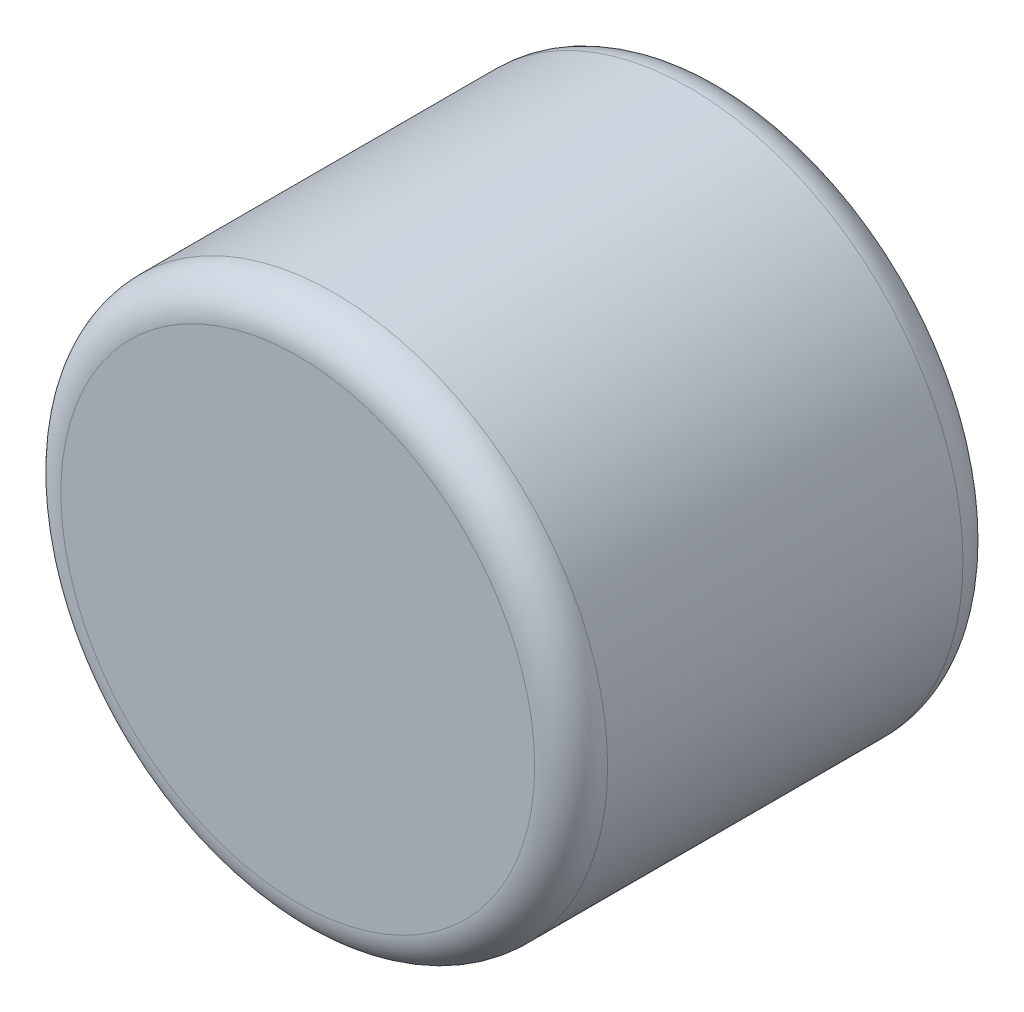
from build123d import *

# Parameters (mm, degrees)
IZIM1_R                     = 7.5
Y_KSEKLIK_EKSTR_ZYON1_DEPTH = 11.75
KES_EKSTR_ZYON1_DEPTH       = 7
RADYUS1_R                   = 1
KES_EKSTR_ZYON2_START       = -2.75
IZIM3_R                     = 3.05
KES_EKSTR_ZYON2_DEPTH       = 2.75


with BuildPart() as part:
    # Çizim1 → Yükseklik-Ekstrüzyon1 (new body)
    with BuildSketch(Plane.XY):
        Circle(IZIM1_R)
    extrude(amount=Y_KSEKLIK_EKSTR_ZYON1_DEPTH)

    # Çizim2 → Kes-Ekstrüzyon1 (cut)
    with BuildSketch(Plane.XY.offset(9.75)):
        with BuildLine():
            Line((-2.655654345, -1.5), (2.655654345, -1.5))
            ThreePointArc((2.655654345, -1.5), (0, 3.05), (-2.655654345, -1.5))
        make_face()
    extrude(amount=-KES_EKSTR_ZYON1_DEPTH, mode=Mode.SUBTRACT)

    # Radyus1
    radyus1_edges = [part.edges().sort_by_distance(p)[0] for p in [
        (-7.5, 0, 0),
        (-7.5, 0, 11.75),
    ]]
    fillet(radyus1_edges, radius=RADYUS1_R)

    # Çizim3 → Kes-Ekstrüzyon2 (cut)
    with BuildSketch(Plane(origin=(0, 0, 0), x_dir=(-1, 0, 0), z_dir=(0, 0, -1)).offset(KES_EKSTR_ZYON2_START)):
        with Locations(Location((0, 0, 0), (0, 0, 209.459174912))):
            Circle(IZIM3_R)
    extrude(amount=KES_EKSTR_ZYON2_DEPTH, mode=Mode.SUBTRACT)


solid = part.part
